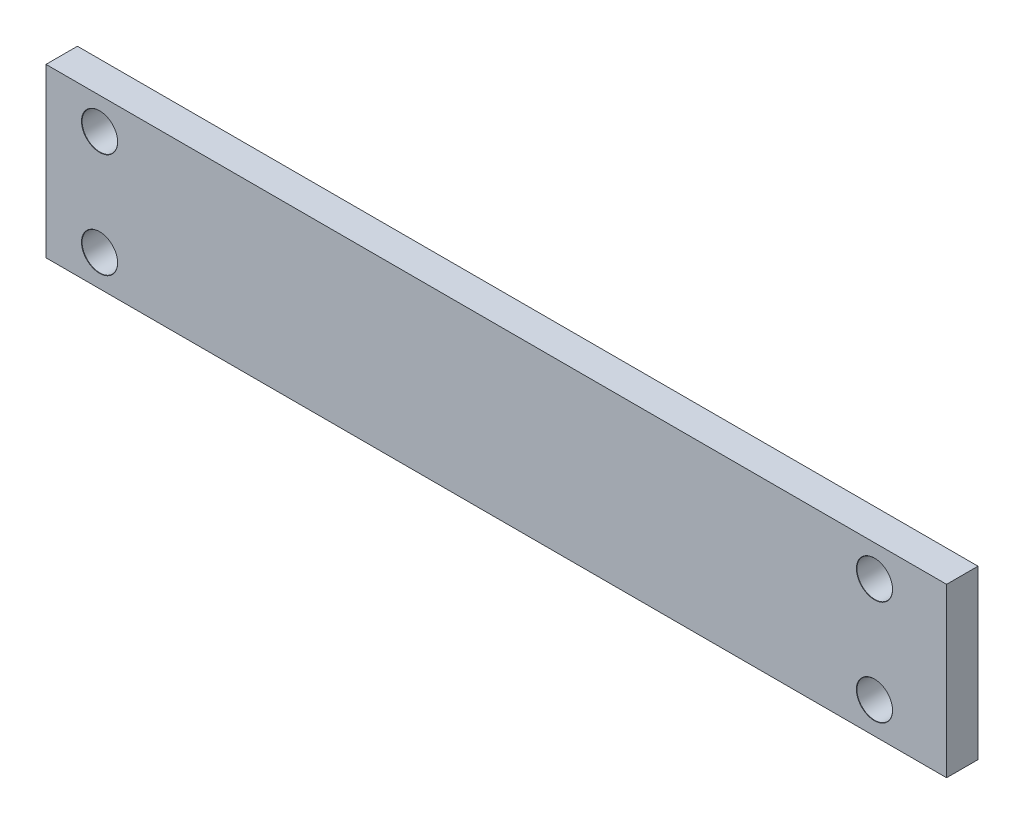
from build123d import *

# Parameters (mm, degrees)
SKETCH1_W                      = 86
SKETCH1_H                      = 16
BOSS_EXTRUDE1_DEPTH            = 3
M3_CLEARANCE_HOLE1_D           = 3.4
M3_CLEARANCE_HOLE1_CSINK_D     = 3.45
M3_CLEARANCE_HOLE1_CSINK_ANGLE = 90


with BuildPart() as part:
    # Sketch1 → Boss-Extrude1 (new body)
    with BuildSketch(Plane.XY):
        with Locations((43, 8)):
            Rectangle(SKETCH1_W, SKETCH1_H)
    extrude(amount=BOSS_EXTRUDE1_DEPTH)

    # M3 Clearance Hole1 (through all)
    with Locations(Plane.XY.offset(3)):
        with Locations((5.115834522, 13), (5.115834522, 3), (79.115834522, 13), (79.115834522, 3)):
            CounterSinkHole(M3_CLEARANCE_HOLE1_D / 2, M3_CLEARANCE_HOLE1_CSINK_D / 2, counter_sink_angle=M3_CLEARANCE_HOLE1_CSINK_ANGLE)


solid = part.part
